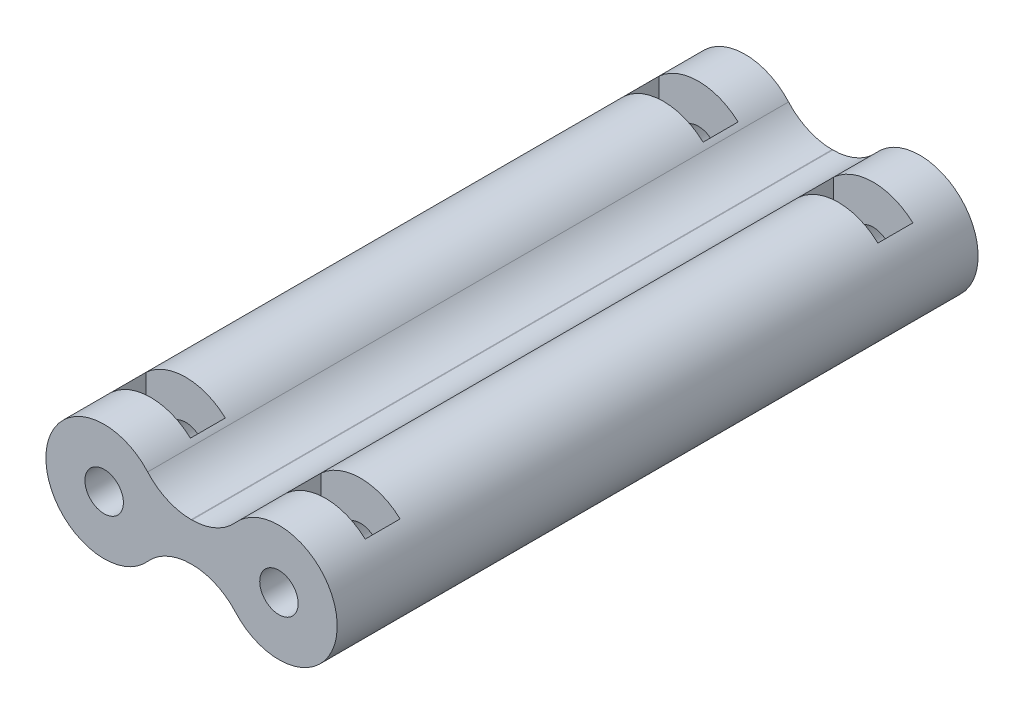
from build123d import *

# Parameters (mm, degrees)
ESBO_O1_R                  = 1.65
RESSALTO_EXTRUS_O1_DEPTH   = 55
FILETE1_R                  = 5
CORTE_EXTRUS_O1_DEPTH      = 57.623758265
CORTE_EXTRUS_O1_DEPTH_BACK = 57.623758265
ESBO_O2_W                  = 6.8
ESBO_O2_H                  = 3


with BuildPart() as part:
    # Esboço1 → Ressalto-extrusão1 (new body)
    with BuildSketch(Plane.XY):
        with BuildLine():
            Line((-2.78009534, 1.65), (2.78009534, 1.65))
            ThreePointArc((2.78009534, 1.65), (12.5, 0), (2.78009534, -1.65))
            Line((2.78009534, -1.65), (-2.78009534, -1.65))
            ThreePointArc((-2.78009534, -1.65), (-12.5, 0), (-2.78009534, 1.65))
        make_face()
        with Locations((-7.5, 0)):
            Circle(ESBO_O1_R, mode=Mode.SUBTRACT)
        with Locations((7.5, 0)):
            Circle(ESBO_O1_R, mode=Mode.SUBTRACT)
    extrude(amount=RESSALTO_EXTRUS_O1_DEPTH)

    # Filete1
    filete1_edges = [part.edges().sort_by_distance(p)[0] for p in [
        (-2.78009534, 1.65, 27.5),
        (2.78009534, 1.65, 27.5),
        (2.78009534, -1.65, 27.5),
        (-2.78009534, -1.65, 27.5),
    ]]
    fillet(filete1_edges, radius=FILETE1_R)

    # Esboço2 → Corte-extrusão1 (cut, two sides: drawn at the far end of the back side and taken through both)
    with BuildSketch(Plane(origin=(0, 0, 0), x_dir=(1, 0, 0), z_dir=(0, 1, 0)).offset(-CORTE_EXTRUS_O1_DEPTH_BACK)):
        with Locations((-7.5, -5.5)):
            Rectangle(ESBO_O2_W, ESBO_O2_H)
        with Locations((7.5, -5.5)):
            Rectangle(ESBO_O2_W, ESBO_O2_H)
        with Locations((7.5, -49.5)):
            Rectangle(ESBO_O2_W, ESBO_O2_H)
        with Locations((-7.5, -49.5)):
            Rectangle(ESBO_O2_W, ESBO_O2_H)
    extrude(amount=CORTE_EXTRUS_O1_DEPTH + CORTE_EXTRUS_O1_DEPTH_BACK, mode=Mode.SUBTRACT)


solid = part.part
